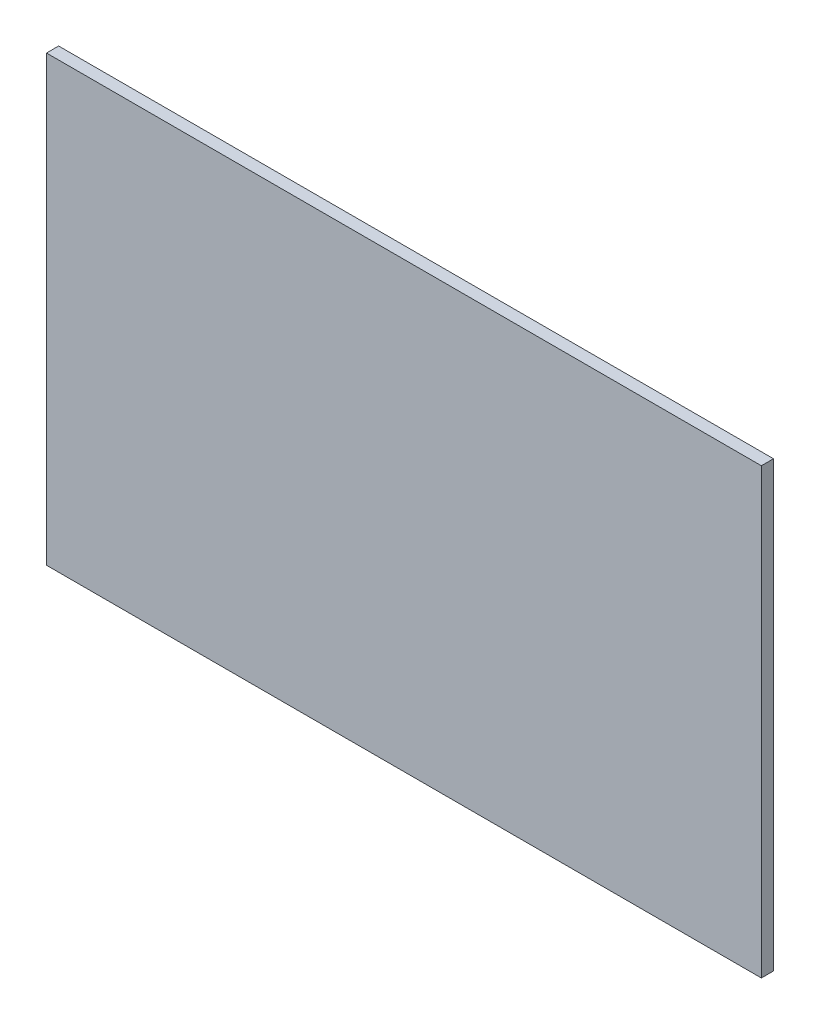
from build123d import *

# Parameters (mm, degrees)
ESQUISSE1_W        = 294.410230147
ESQUISSE1_H        = 182.706286851
BOSS_EXTRU_1_DEPTH = 5


with BuildPart() as part:
    # Esquisse1 → Boss.-Extru.1 (new body)
    with BuildSketch(Plane.XY):
        with Locations((-12.707948776, 3.871916574)):
            Rectangle(ESQUISSE1_W, ESQUISSE1_H)
    extrude(amount=BOSS_EXTRU_1_DEPTH)


solid = part.part
